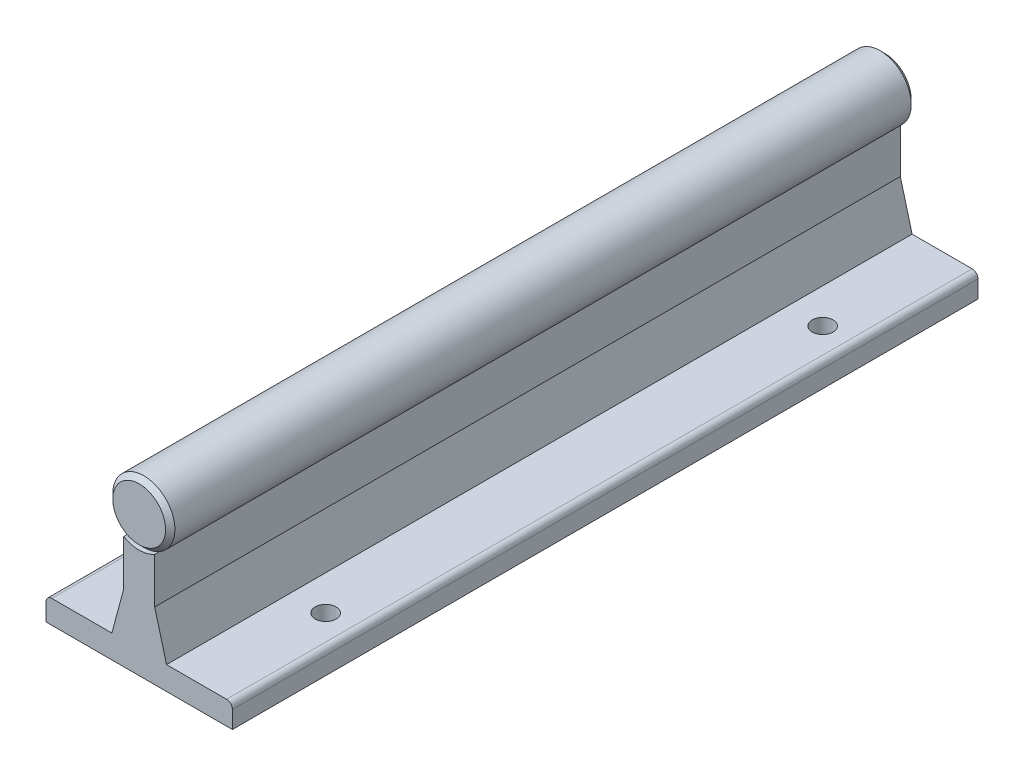
from build123d import *

# Parameters (mm, degrees)
EXTRUDE1_DEPTH  = 76.2
FILLET1_R       = 1.190625
SKETCH4_R       = 2.1463
EXTRUDE3_DEPTH  = 4.7625
LPATTERN1_COUNT = 19
LPATTERN1_PITCH = 101.6


with BuildPart() as part:
    # Sketch1 → Extrude1 (new, symmetric)
    with BuildSketch(Plane.XY):
        with BuildLine():
            Line((-19.05, 0), (19.05, 0))
            Line((19.05, 0), (19.05, 4.7625))
            Line((19.05, 4.7625), (5.585983612, 4.7625))
            Line((5.585983612, 4.7625), (3.175, 13.760413336))
            Line((3.175, 13.760413336), (3.175, 23.075738686))
            ThreePointArc((3.175, 23.075738686), (0, 34.925), (-3.175, 23.075738686))
            Line((-3.175, 23.075738686), (-3.175, 13.760413336))
            Line((-3.175, 13.760413336), (-5.585983612, 4.7625))
            Line((-5.585983612, 4.7625), (-19.05, 4.7625))
            Line((-19.05, 4.7625), (-19.05, 0))
        make_face()
    extrude(amount=EXTRUDE1_DEPTH, both=True)

    # Sketch3 → Cut-Revolve1 (revolve, cut)
    with BuildSketch(Plane(origin=(0, 0, 0), x_dir=(0, 0, -1), z_dir=(1, 0, 0)), mode=Mode.PRIVATE) as cut_revolve1_sk:
        Polygon((-76.2, 33.9725), (-75.2475, 34.925), (-76.2, 34.925), align=None)
    cut_revolve1 = revolve(cut_revolve1_sk.sketch.rotate(Axis((0, 28.575, 76.2), (0, 0, -1)), 210), axis=Axis((0, 28.575, 76.2), (0, 0, -1)), mode=Mode.SUBTRACT)

    # Mirror1: Cut-Revolve1 across plane
    add(cut_revolve1.mirror(Plane.XY), mode=Mode.SUBTRACT)

    # Fillet1
    fillet1_edges = [part.edges().sort_by_distance(p)[0] for p in [
        (-19.05, 4.7625, 0),
        (19.05, 4.7625, 0),
    ]]
    fillet(fillet1_edges, radius=FILLET1_R)

    # Sketch4 → Extrude3 (cut)
    with BuildSketch(Plane(origin=(0, 0, 0), x_dir=(1, 0, 0), z_dir=(0, 1, 0))):
        with Locations((12.7, -50.8)):
            Circle(SKETCH4_R)
        with Locations((-12.7, -50.8)):
            Circle(SKETCH4_R)
    extrude3 = extrude(amount=EXTRUDE3_DEPTH, mode=Mode.SUBTRACT)

    # LPattern1: Extrude3 ×19
    with Locations(*[(0, 0, -i * LPATTERN1_PITCH) for i in range(1, LPATTERN1_COUNT)]):
        add(extrude3, mode=Mode.SUBTRACT)


solid = part.part
